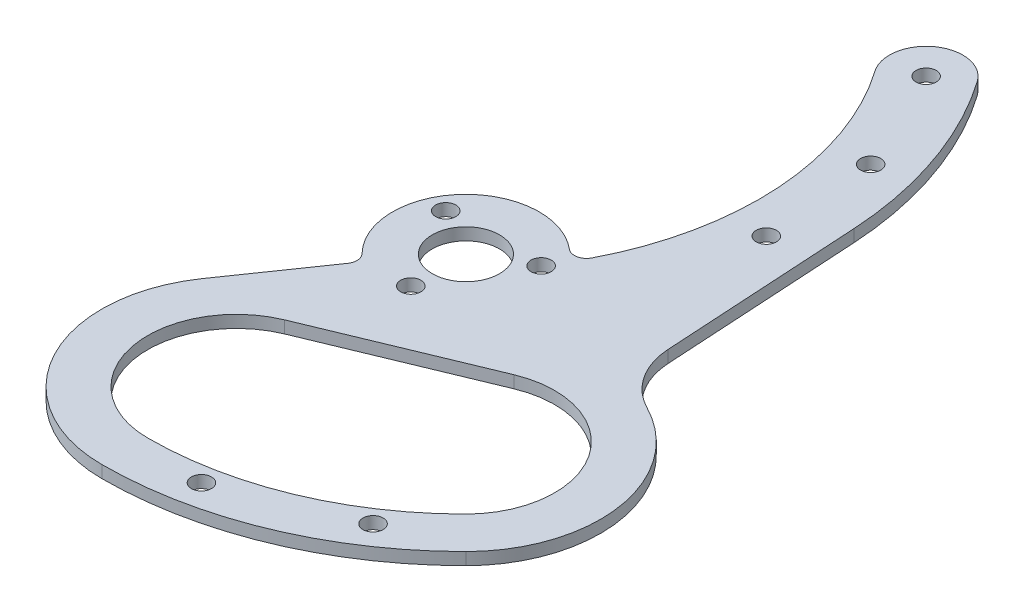
from build123d import *

# Parameters (mm, degrees)
SKETCH_1_R          = 1.65
SKETCH_1_R_2        = 5.5
EXTRUDE_1_DEPTH     = 2
SKETCH_2_R          = 1.65
CUT_EXTRUDE_1_DEPTH = 85.204030668
FILLET_1_R          = 2
FILLET_2_R          = 12


with BuildPart() as part:
    # Эскиз1 → Бобышка-Вытянуть1 (new body)
    with BuildSketch(Plane(origin=(0, 0, 0), x_dir=(1, 0, 0), z_dir=(0, 1, 0))):
        with BuildLine():
            Line((-7.358068948, -9.479389292), (-18.08780174, -24.976764467))
            ThreePointArc((-18.08780174, -24.976764467), (-19.487318719, -47.710015139), (0, -59.5))
            ThreePointArc((0, -59.5), (22.769664226, -54.970832184), (42.072853481, -42.072853481))
            ThreePointArc((42.072853481, -42.072853481), (47.515690449, -19.956460022), (30.451246794, -4.87123226))
            Line((30.451246794, -4.87123226), (28.075866666, 35.356540564))
            ThreePointArc((28.075866666, 35.356540564), (24.846341863, 51.541564262), (17.329317504, 66.234391334))
            ThreePointArc((17.329317504, 66.234391334), (8.97294662, 67.707844982), (7.499492972, 59.351474098))
            ThreePointArc((7.499492972, 59.351474098), (16.145431017, 33.64630977), (9.479389292, 7.358068948))
            ThreePointArc((9.479389292, 7.358068948), (-8.485281374, 8.485281374), (-7.358068948, -9.479389292))
        make_face()
        with Locations(Location((10.729967711, -53.943190422, 0), (0, 0, 270))):
            Circle(SKETCH_1_R, mode=Mode.SUBTRACT)
        with Locations(Location((30.556362816, -45.730828677, 0), (0, 0, 90))):
            Circle(SKETCH_1_R, mode=Mode.SUBTRACT)
        with Locations(Location((0, 0, 0), (0, 0, 270))):
            Circle(SKETCH_1_R_2, mode=Mode.SUBTRACT)
        with Locations(Location((0, -9, 0), (0, 0, 270))):
            Circle(SKETCH_1_R, mode=Mode.SUBTRACT)
        with Locations(Location((-7.794228634, 4.5, 0), (0, 0, 270))):
            Circle(SKETCH_1_R, mode=Mode.SUBTRACT)
        with Locations(Location((7.794228634, 4.5, 0), (0, 0, 270))):
            Circle(SKETCH_1_R, mode=Mode.SUBTRACT)
        with BuildLine():
            Line((-5.548909769, -24.103746779), (20.967594525, -13.120251073))
            ThreePointArc((20.967594525, -13.120251073), (38.572813673, -18.460735916), (36.769552622, -36.769552622))
            ThreePointArc((36.769552622, -36.769552622), (19.899538483, -48.041735691), (0, -52))
            ThreePointArc((0, -52), (-14.221386566, -40.328809669), (-5.548909769, -24.103746779))
        make_face(mode=Mode.SUBTRACT)
    extrude(amount=EXTRUDE_1_DEPTH)

    # Эскиз2 → Вырез-Вытянуть1 (cut, through all)
    with BuildSketch(Plane.XZ):
        with Locations(Location((21.974708544, -27.113395045, 0), (0, 0, 270))):
            Circle(SKETCH_2_R)
        with Locations(Location((12.414405238, -62.792932716, 0), (0, 0, 270))):
            Circle(SKETCH_2_R)
        with Locations(Location((20.340189466, -45.796033589, 0), (0, 0, 270))):
            Circle(SKETCH_2_R)
    extrude(amount=-CUT_EXTRUDE_1_DEPTH, mode=Mode.SUBTRACT)

    # Скругление1
    fillet_1_edges = [part.edges().sort_by_distance(p)[0] for p in [
        (-7.358068948, 1, 9.479389292),
        (9.479389292, 1, -7.358068948),
    ]]
    fillet(fillet_1_edges, radius=FILLET_1_R)

    # Скругление2
    fillet_2_edges = [part.edges().sort_by_distance(p)[0] for p in [
        (30.451246794, 1, 4.87123226),
    ]]
    fillet(fillet_2_edges, radius=FILLET_2_R)


solid = part.part
